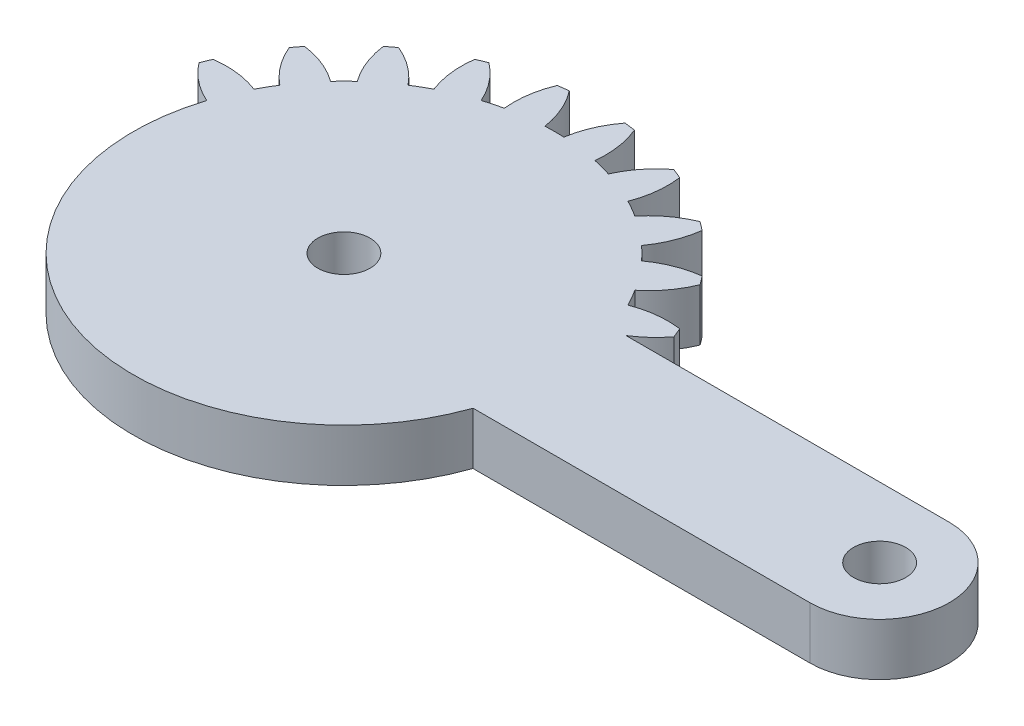
from build123d import *
from build123d.topology import SkipClean

# Parameters (mm, degrees)
SKETCH1_R           = 1.5
BOSS_EXTRUDE1_DEPTH = 3
CUT_EXTRUDE1_START  = -10
CUT_EXTRUDE1_DEPTH  = 10


with BuildPart() as part:
    # Sketch1 → Boss-Extrude1 (new body)
    with BuildSketch(Plane(origin=(0, 0, 0), x_dir=(1, 0, 0), z_dir=(0, 1, 0))):
        with BuildLine():
            Line((20.643657446, 4), (2.081641936, 4))
            ThreePointArc((2.081641936, 4), (2.861028333, 4.588201733), (3.521749436, 5.30713988))
            ThreePointArc((3.521749436, 5.30713988), (3.405395609, 5.596745198), (3.282888305, 5.883801663))
            ThreePointArc((3.282888305, 5.883801663), (1.93527598, 5.894040025), (0.627094961, 5.57027124))
            ThreePointArc((0.627094961, 5.57027124), (0.366286148, 6.046375), (0.084372603, 6.510293938))
            ThreePointArc((0.084372603, 6.510293938), (1.018855105, 7.48132754), (1.683794586, 8.65351323))
            ThreePointArc((1.683794586, 8.65351323), (1.496450048, 8.903135899), (1.303821399, 9.148703928))
            ThreePointArc((1.303821399, 9.148703928), (-0.000522033, 8.809805691), (-1.180330337, 8.158486898))
            ThreePointArc((-1.180330337, 8.158486898), (-1.555477026, 8.550865528), (-1.947855656, 8.926012217))
            ThreePointArc((-1.947855656, 8.926012217), (-1.296536862, 10.105820521), (-0.957638625, 11.410163953))
            ThreePointArc((-0.957638625, 11.410163953), (-1.203206655, 11.602792602), (-1.452829324, 11.79013714))
            ThreePointArc((-1.452829324, 11.79013714), (-2.625015014, 11.125197659), (-3.596048616, 10.190715157))
            ThreePointArc((-3.596048616, 10.190715157), (-4.059967554, 10.472628702), (-4.536071314, 10.733437515))
            ThreePointArc((-4.536071314, 10.733437515), (-4.212302529, 12.041618533), (-4.222540891, 13.389230859))
            ThreePointArc((-4.222540891, 13.389230859), (-4.509597355, 13.511738163), (-4.799202674, 13.62809199))
            ThreePointArc((-4.799202674, 13.62809199), (-5.759348103, 12.682425791), (-6.455432668, 11.528463019))
            ThreePointArc((-6.455432668, 11.528463019), (-6.976508546, 11.680699536), (-7.503891752, 11.809396783))
            ThreePointArc((-7.503891752, 11.809396783), (-7.529737283, 13.156800143), (-7.888414517, 14.455843809))
            ThreePointArc((-7.888414517, 14.455843809), (-8.197396993, 14.499881098), (-8.507248835, 14.537314892))
            ThreePointArc((-8.507248835, 14.537314892), (-9.18992168, 13.375367565), (-9.563620196, 12.080565177))
            ThreePointArc((-9.563620196, 12.080565177), (-10.106342554, 12.09275), (-10.649064912, 12.080565177))
            ThreePointArc((-10.649064912, 12.080565177), (-11.022763428, 13.375367565), (-11.705436272, 14.537314892))
            ThreePointArc((-11.705436272, 14.537314892), (-12.015288115, 14.499881098), (-12.324270591, 14.455843809))
            ThreePointArc((-12.324270591, 14.455843809), (-12.682947825, 13.156800143), (-12.708793355, 11.809396783))
            ThreePointArc((-12.708793355, 11.809396783), (-13.236176561, 11.680699536), (-13.757252439, 11.528463019))
            ThreePointArc((-13.757252439, 11.528463019), (-14.453337005, 12.682425791), (-15.413482434, 13.62809199))
            ThreePointArc((-15.413482434, 13.62809199), (-15.703087752, 13.511738163), (-15.990144217, 13.389230859))
            ThreePointArc((-15.990144217, 13.389230859), (-16.000382579, 12.041618533), (-15.676613793, 10.733437515))
            ThreePointArc((-15.676613793, 10.733437515), (-16.152717554, 10.472628702), (-16.616636492, 10.190715157))
            ThreePointArc((-16.616636492, 10.190715157), (-17.587670094, 11.125197659), (-18.759855783, 11.79013714))
            ThreePointArc((-18.759855783, 11.79013714), (-19.009478453, 11.602792602), (-19.255046482, 11.410163953))
            ThreePointArc((-19.255046482, 11.410163953), (-18.916148245, 10.105820521), (-18.264829452, 8.926012217))
            ThreePointArc((-18.264829452, 8.926012217), (-18.657208082, 8.550865528), (-19.032354771, 8.158486898))
            ThreePointArc((-19.032354771, 8.158486898), (-20.212163074, 8.809805691), (-21.516506507, 9.148703928))
            ThreePointArc((-21.516506507, 9.148703928), (-21.709135156, 8.903135899), (-21.896479694, 8.65351323))
            ThreePointArc((-21.896479694, 8.65351323), (-21.231540213, 7.48132754), (-20.297057711, 6.510293938))
            ThreePointArc((-20.297057711, 6.510293938), (-20.578971255, 6.046375), (-20.839780068, 5.57027124))
            ThreePointArc((-20.839780068, 5.57027124), (-22.147961087, 5.894040025), (-23.495573413, 5.883801663))
            ThreePointArc((-23.495573413, 5.883801663), (-23.618080717, 5.596745198), (-23.734434544, 5.30713988))
            ThreePointArc((-23.734434544, 5.30713988), (-22.788768345, 4.346994451), (-21.634805572, 3.650909885))
            ThreePointArc((-21.634805572, 3.650909885), (-21.78704209, 3.129834008), (-21.915739337, 2.602450802))
            ThreePointArc((-21.915739337, 2.602450802), (-23.263142697, 2.576605271), (-24.562186363, 2.217928037))
            ThreePointArc((-24.562186363, 2.217928037), (-24.606223651, 1.908945561), (-24.643657446, 1.599093719))
            ThreePointArc((-24.643657446, 1.599093719), (-23.481710119, 0.916420874), (-22.186907731, 0.542722358))
            ThreePointArc((-22.186907731, 0.542722358), (-22.199092554, 0), (-22.186907731, -0.542722358))
            ThreePointArc((-22.186907731, -0.542722358), (-23.481710119, -0.916420874), (-24.643657446, -1.599093719))
            ThreePointArc((-24.643657446, -1.599093719), (-24.606223651, -1.908945561), (-24.562186363, -2.217928037))
            ThreePointArc((-24.562186363, -2.217928037), (-23.263142697, -2.576605271), (-21.915739337, -2.602450802))
            ThreePointArc((-21.915739337, -2.602450802), (-21.78704209, -3.129834008), (-21.634805572, -3.650909885))
            ThreePointArc((-21.634805572, -3.650909885), (-22.788768345, -4.346994451), (-23.734434544, -5.30713988))
            ThreePointArc((-23.734434544, -5.30713988), (-23.618080717, -5.596745198), (-23.495573413, -5.883801663))
            ThreePointArc((-23.495573413, -5.883801663), (-22.147961087, -5.894040025), (-20.839780068, -5.57027124))
            ThreePointArc((-20.839780068, -5.57027124), (-20.578971255, -6.046375), (-20.297057711, -6.510293938))
            ThreePointArc((-20.297057711, -6.510293938), (-21.231540213, -7.48132754), (-21.896479694, -8.65351323))
            ThreePointArc((-21.896479694, -8.65351323), (-21.709135156, -8.903135899), (-21.516506507, -9.148703928))
            ThreePointArc((-21.516506507, -9.148703928), (-20.212163074, -8.809805691), (-19.032354771, -8.158486898))
            ThreePointArc((-19.032354771, -8.158486898), (-18.657208082, -8.550865528), (-18.264829452, -8.926012217))
            ThreePointArc((-18.264829452, -8.926012217), (-18.916148245, -10.105820521), (-19.255046482, -11.410163953))
            ThreePointArc((-19.255046482, -11.410163953), (-19.009478453, -11.602792602), (-18.759855783, -11.79013714))
            ThreePointArc((-18.759855783, -11.79013714), (-17.587670094, -11.125197659), (-16.616636492, -10.190715157))
            ThreePointArc((-16.616636492, -10.190715157), (-16.152717554, -10.472628702), (-15.676613793, -10.733437515))
            ThreePointArc((-15.676613793, -10.733437515), (-16.000382579, -12.041618533), (-15.990144217, -13.389230859))
            ThreePointArc((-15.990144217, -13.389230859), (-15.703087752, -13.511738163), (-15.413482434, -13.62809199))
            ThreePointArc((-15.413482434, -13.62809199), (-14.453337005, -12.682425791), (-13.757252439, -11.528463019))
            ThreePointArc((-13.757252439, -11.528463019), (-13.236176561, -11.680699536), (-12.708793355, -11.809396783))
            ThreePointArc((-12.708793355, -11.809396783), (-12.682947825, -13.156800143), (-12.324270591, -14.455843809))
            ThreePointArc((-12.324270591, -14.455843809), (-12.015288115, -14.499881098), (-11.705436272, -14.537314892))
            ThreePointArc((-11.705436272, -14.537314892), (-11.022763428, -13.375367565), (-10.649064912, -12.080565177))
            ThreePointArc((-10.649064912, -12.080565177), (-10.106342554, -12.09275), (-9.563620196, -12.080565177))
            ThreePointArc((-9.563620196, -12.080565177), (-9.18992168, -13.375367565), (-8.507248835, -14.537314892))
            ThreePointArc((-8.507248835, -14.537314892), (-8.197396993, -14.499881098), (-7.888414517, -14.455843809))
            ThreePointArc((-7.888414517, -14.455843809), (-7.529737283, -13.156800143), (-7.503891752, -11.809396783))
            ThreePointArc((-7.503891752, -11.809396783), (-6.976508546, -11.680699536), (-6.455432668, -11.528463019))
            ThreePointArc((-6.455432668, -11.528463019), (-5.759348103, -12.682425791), (-4.799202674, -13.62809199))
            ThreePointArc((-4.799202674, -13.62809199), (-4.509597355, -13.511738163), (-4.222540891, -13.389230859))
            ThreePointArc((-4.222540891, -13.389230859), (-4.212302529, -12.041618533), (-4.536071314, -10.733437515))
            ThreePointArc((-4.536071314, -10.733437515), (-4.059967554, -10.472628702), (-3.596048616, -10.190715157))
            ThreePointArc((-3.596048616, -10.190715157), (-2.625015014, -11.125197659), (-1.452829324, -11.79013714))
            ThreePointArc((-1.452829324, -11.79013714), (-1.203206655, -11.602792602), (-0.957638625, -11.410163953))
            ThreePointArc((-0.957638625, -11.410163953), (-1.296536862, -10.105820521), (-1.947855656, -8.926012217))
            ThreePointArc((-1.947855656, -8.926012217), (-1.555477026, -8.550865528), (-1.180330337, -8.158486898))
            ThreePointArc((-1.180330337, -8.158486898), (-0.000522033, -8.809805691), (1.303821399, -9.148703928))
            ThreePointArc((1.303821399, -9.148703928), (1.496450048, -8.903135899), (1.683794586, -8.65351323))
            ThreePointArc((1.683794586, -8.65351323), (1.018855105, -7.48132754), (0.084372603, -6.510293938))
            ThreePointArc((0.084372603, -6.510293938), (0.366286148, -6.046375), (0.627094961, -5.57027124))
            ThreePointArc((0.627094961, -5.57027124), (1.93527598, -5.894040025), (3.282888305, -5.883801663))
            ThreePointArc((3.282888305, -5.883801663), (3.405395609, -5.596745198), (3.521749436, -5.30713988))
            ThreePointArc((3.521749436, -5.30713988), (2.861028333, -4.588201733), (2.081641936, -4))
            Line((2.081641936, -4), (20.643657446, -4))
            ThreePointArc((20.643657446, -4), (24.643657446, 0), (20.643657446, 4))
        make_face()
        with Locations(Location((-10.106342554, 0, 0), (0, 0, 270))):
            Circle(SKETCH1_R, mode=Mode.SUBTRACT)
        with Locations(Location((20.643657446, 0, 0), (0, 0, 270))):
            Circle(SKETCH1_R, mode=Mode.SUBTRACT)
    extrude(amount=BOSS_EXTRUDE1_DEPTH)

    # Sketch2 → Cut-Extrude1 (cut)
    with SkipClean():  # the faces are left unmerged after this step: merging them gives an invalid solid
        with BuildSketch(Plane(origin=(0, 3, 0), x_dir=(1, 0, 0), z_dir=(0, 1, 0)).offset(CUT_EXTRUDE1_START)):
            with BuildLine():
                ThreePointArc((-24.562186363, -2.217928037), (-23.263142697, -2.576605271), (-21.915739337, -2.602450802))
                ThreePointArc((-21.915739337, -2.602450802), (-22.095637401, -1.578420611), (-22.186907731, -0.542722358))
                ThreePointArc((-22.186907731, -0.542722358), (-23.481710119, -0.916420874), (-24.643657446, -1.599093719))
                ThreePointArc((-24.643657446, -1.599093719), (-24.606223651, -1.908945561), (-24.562186363, -2.217928037))
            make_face()
            with BuildLine():
                ThreePointArc((-23.495573413, -5.883801663), (-22.147961087, -5.894040025), (-20.839780068, -5.57027124))
                ThreePointArc((-20.839780068, -5.57027124), (-21.278586771, -4.627695077), (-21.634805572, -3.650909885))
                ThreePointArc((-21.634805572, -3.650909885), (-22.788768345, -4.346994451), (-23.734434544, -5.30713988))
                ThreePointArc((-23.734434544, -5.30713988), (-23.618080717, -5.596745198), (-23.495573413, -5.883801663))
            make_face()
            with BuildLine():
                ThreePointArc((-21.516506507, -9.148703928), (-20.212163074, -8.809805691), (-19.032354771, -8.158486898))
                ThreePointArc((-19.032354771, -8.158486898), (-19.70016616, -7.361599771), (-20.297057711, -6.510293938))
                ThreePointArc((-20.297057711, -6.510293938), (-21.231540213, -7.48132754), (-21.896479694, -8.65351323))
                ThreePointArc((-21.896479694, -8.65351323), (-21.709135156, -8.903135899), (-21.516506507, -9.148703928))
            make_face()
            with BuildLine():
                ThreePointArc((-18.759855783, -11.79013714), (-17.587670094, -11.125197659), (-16.616636492, -10.190715157))
                ThreePointArc((-16.616636492, -10.190715157), (-17.467942324, -9.593823606), (-18.264829452, -8.926012217))
                ThreePointArc((-18.264829452, -8.926012217), (-18.916148245, -10.105820521), (-19.255046482, -11.410163953))
                ThreePointArc((-19.255046482, -11.410163953), (-19.009478453, -11.602792602), (-18.759855783, -11.79013714))
            make_face()
            with BuildLine():
                ThreePointArc((-15.413482434, -13.62809199), (-14.453337005, -12.682425791), (-13.757252439, -11.528463019))
                ThreePointArc((-13.757252439, -11.528463019), (-14.734037631, -11.172244217), (-15.676613793, -10.733437515))
                ThreePointArc((-15.676613793, -10.733437515), (-16.000382579, -12.041618533), (-15.990144217, -13.389230859))
                ThreePointArc((-15.990144217, -13.389230859), (-15.703087752, -13.511738163), (-15.413482434, -13.62809199))
            make_face()
            with BuildLine():
                ThreePointArc((-11.705436272, -14.537314892), (-11.022763428, -13.375367565), (-10.649064912, -12.080565177))
                ThreePointArc((-10.649064912, -12.080565177), (-11.684763165, -11.989294847), (-12.708793355, -11.809396783))
                ThreePointArc((-12.708793355, -11.809396783), (-12.682947825, -13.156800143), (-12.324270591, -14.455843809))
                ThreePointArc((-12.324270591, -14.455843809), (-12.015288115, -14.499881098), (-11.705436272, -14.537314892))
            make_face()
            with BuildLine():
                ThreePointArc((-7.888414517, -14.455843809), (-7.529737283, -13.156800143), (-7.503891752, -11.809396783))
                ThreePointArc((-7.503891752, -11.809396783), (-8.527921943, -11.989294847), (-9.563620196, -12.080565177))
                ThreePointArc((-9.563620196, -12.080565177), (-9.18992168, -13.375367565), (-8.507248835, -14.537314892))
                ThreePointArc((-8.507248835, -14.537314892), (-8.197396993, -14.499881098), (-7.888414517, -14.455843809))
            make_face()
            with BuildLine():
                ThreePointArc((-4.222540891, -13.389230859), (-4.212302529, -12.041618533), (-4.536071314, -10.733437515))
                ThreePointArc((-4.536071314, -10.733437515), (-5.478647477, -11.172244217), (-6.455432668, -11.528463019))
                ThreePointArc((-6.455432668, -11.528463019), (-5.759348103, -12.682425791), (-4.799202674, -13.62809199))
                ThreePointArc((-4.799202674, -13.62809199), (-4.509597355, -13.511738163), (-4.222540891, -13.389230859))
            make_face()
            with BuildLine():
                ThreePointArc((-0.957638625, -11.410163953), (-1.296536862, -10.105820521), (-1.947855656, -8.926012217))
                ThreePointArc((-1.947855656, -8.926012217), (-2.744742783, -9.593823606), (-3.596048616, -10.190715157))
                ThreePointArc((-3.596048616, -10.190715157), (-2.625015014, -11.125197659), (-1.452829324, -11.79013714))
                ThreePointArc((-1.452829324, -11.79013714), (-1.203206655, -11.602792602), (-0.957638625, -11.410163953))
            make_face()
            with BuildLine():
                ThreePointArc((1.683794586, -8.65351323), (1.018855105, -7.48132754), (0.084372603, -6.510293938))
                ThreePointArc((0.084372603, -6.510293938), (-0.512518948, -7.361599771), (-1.180330337, -8.158486898))
                ThreePointArc((-1.180330337, -8.158486898), (-0.000522033, -8.809805691), (1.303821399, -9.148703928))
                ThreePointArc((1.303821399, -9.148703928), (1.496450048, -8.903135899), (1.683794586, -8.65351323))
            make_face()
            with BuildLine():
                ThreePointArc((3.521749436, -5.30713988), (2.861028333, -4.588201733), (2.081641936, -4))
                Line((2.081641936, -4), (1.305695063, -4))
                ThreePointArc((1.305695063, -4), (0.994195953, -4.797149927), (0.627094961, -5.57027124))
                ThreePointArc((0.627094961, -5.57027124), (1.93527598, -5.894040025), (3.282888305, -5.883801663))
                ThreePointArc((3.282888305, -5.883801663), (3.405395609, -5.596745198), (3.521749436, -5.30713988))
            make_face()
            with BuildLine():
                ThreePointArc((-22.186907731, 0.542722358), (-22.095637401, 1.578420611), (-21.915739337, 2.602450802))
                ThreePointArc((-21.915739337, 2.602450802), (-23.263142697, 2.576605271), (-24.562186363, 2.217928037))
                ThreePointArc((-24.562186363, 2.217928037), (-24.606223651, 1.908945561), (-24.643657446, 1.599093719))
                ThreePointArc((-24.643657446, 1.599093719), (-23.481710119, 0.916420874), (-22.186907731, 0.542722358))
            make_face()
        extrude(amount=CUT_EXTRUDE1_DEPTH, mode=Mode.SUBTRACT)


solid = part.part
